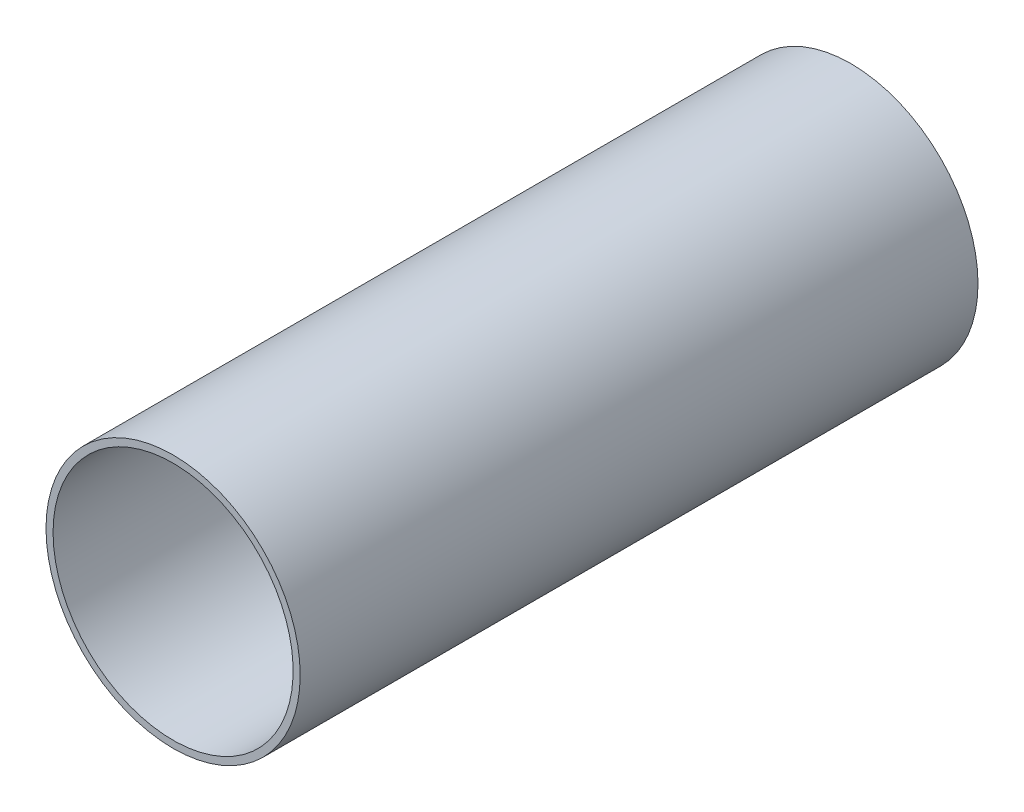
from build123d import *

# Parameters (mm, degrees)
BOSS_EXTRUDE1_DEPTH      = 152.4
BOSS_EXTRUDE1_DEPTH_BACK = 152.4
SKETCH3_R                = 57.15
SKETCH3_R_2              = 53.975


with BuildPart() as part:
    # Sketch3 → Boss-Extrude1 (new, two sides: drawn at the far end of the back side and taken through both)
    with BuildSketch(Plane.XY.offset(-BOSS_EXTRUDE1_DEPTH_BACK)):
        with Locations(Location((0, 0, 0), (0, 0, 180))):
            Circle(SKETCH3_R)
        with Locations(Location((0, 0, 0), (0, 0, 180))):
            Circle(SKETCH3_R_2, mode=Mode.SUBTRACT)
    extrude(amount=BOSS_EXTRUDE1_DEPTH + BOSS_EXTRUDE1_DEPTH_BACK)


solid = part.part
